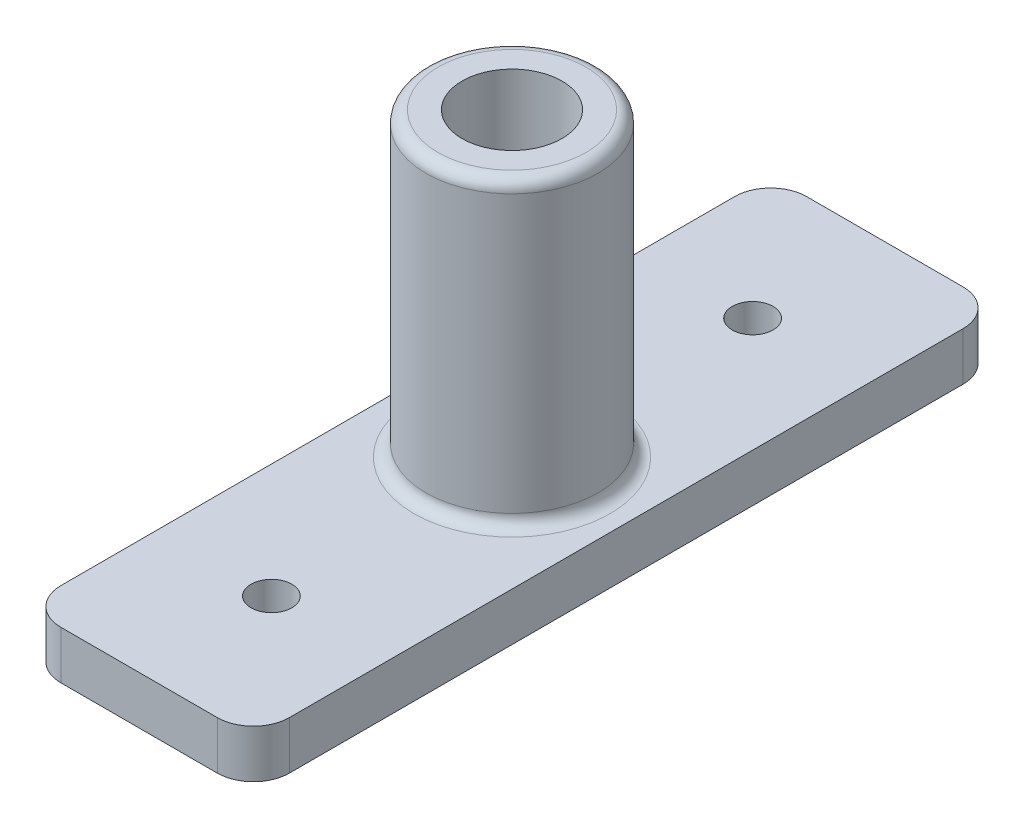
from build123d import *

# Parameters (mm, degrees)
SKETCH_2_W      = 19
SKETCH_2_H      = 62
SKETCH_2_R      = 1.7
EXTRUDE_1_DEPTH = 4
SKETCH_3_R      = 7.15
SKETCH_3_R_2    = 4.15
EXTRUDE_2_DEPTH = 25
FILLET_1_R      = 3
FILLET_2_R      = 1


with BuildPart() as part:
    # 草图2 → 凸台-拉伸1 (new body)
    with BuildSketch(Plane(origin=(0, 0, 0), x_dir=(1, 0, 0), z_dir=(0, 1, 0))):
        Rectangle(SKETCH_2_W, SKETCH_2_H)
        with Locations(Location((0, 20, 0), (0, 0, 270))):
            Circle(SKETCH_2_R, mode=Mode.SUBTRACT)
        with Locations(Location((0, -20, 0), (0, 0, 270))):
            Circle(SKETCH_2_R, mode=Mode.SUBTRACT)
    extrude(amount=EXTRUDE_1_DEPTH)

    # 草图3 → 凸台-拉伸2 (add)
    with BuildSketch(Plane(origin=(0, 4, 0), x_dir=(1, 0, 0), z_dir=(0, 1, 0))):
        with Locations(Location((0, 0, 0), (0, 0, 270))):
            Circle(SKETCH_3_R)
        with Locations(Location((0, 0, 0), (0, 0, 270))):
            Circle(SKETCH_3_R_2, mode=Mode.SUBTRACT)
    extrude(amount=EXTRUDE_2_DEPTH)

    # 圆角1
    fillet_1_edges = [part.edges().sort_by_distance(p)[0] for p in [
        (-9.5, 2, -31),
        (9.5, 2, -31),
        (9.5, 2, 31),
        (-9.5, 2, 31),
    ]]
    fillet(fillet_1_edges, radius=FILLET_1_R)

    # 圆角2
    fillet_2_edges = [part.edges().sort_by_distance(p)[0] for p in [
        (0, 29, -7.15),
        (0, 4, -7.15),
    ]]
    fillet(fillet_2_edges, radius=FILLET_2_R)


solid = part.part
